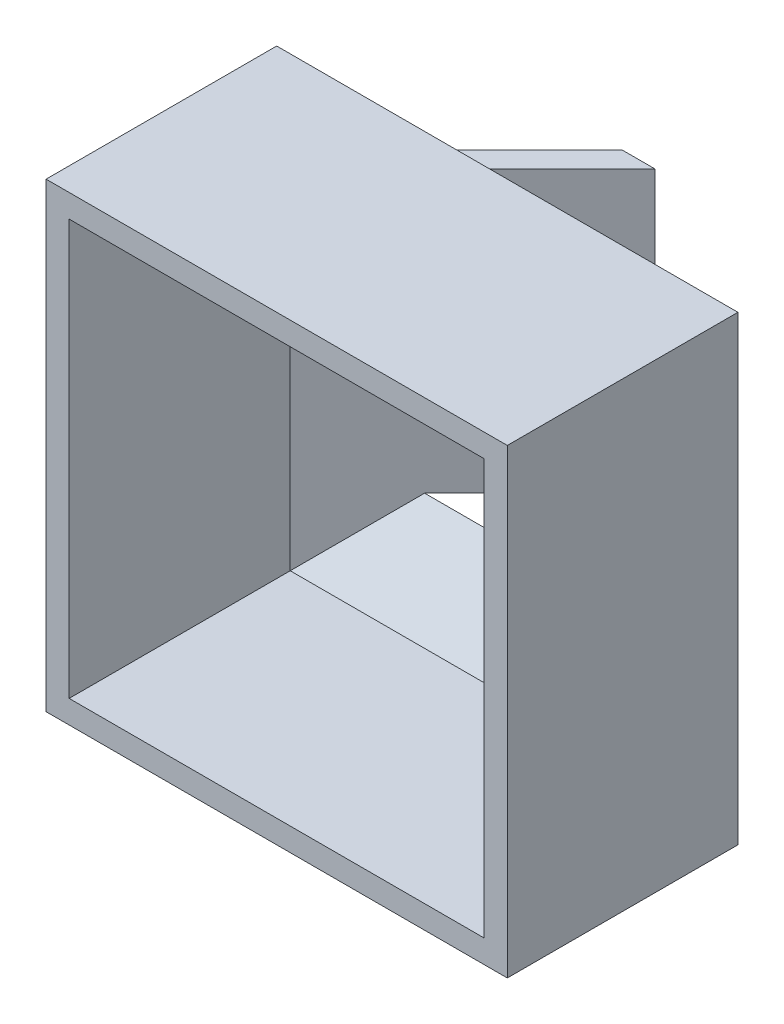
from build123d import *

# Parameters (mm, degrees)
SKETCH1_W           = 40
SKETCH1_H           = 40
BOSS_EXTRUDE1_DEPTH = 25
CHAMFER1_SIZE       = 5
CHAMFER2_SIZE       = 5
CHAMFER3_SIZE       = 5
CHAMFER4_SIZE       = 5
SHELL1_T            = -2
SKETCH7_W           = 10
SKETCH7_H           = 24.34314575
BOSS_EXTRUDE6_DEPTH = 10
CUT_EXTRUDE2_DEPTH  = 24.343146
SKETCH11_W          = 10
SKETCH11_H          = 24.34314575
BOSS_EXTRUDE8_DEPTH = 2.828427
CUT_EXTRUDE4_DEPTH  = 58.096498152


with BuildPart() as part:
    # Sketch1 → Boss-Extrude1 (new body)
    with BuildSketch(Plane.XY):
        with Locations((20, -20)):
            Rectangle(SKETCH1_W, SKETCH1_H)
    extrude(amount=BOSS_EXTRUDE1_DEPTH)

    # Chamfer1
    chamfer1_edges = [part.edges().sort_by_distance(p)[0] for p in [
        (0, -20, 0),
    ]]
    chamfer(chamfer1_edges, length=CHAMFER1_SIZE)

    # Chamfer2
    chamfer2_edges = [part.edges().sort_by_distance(p)[0] for p in [
        (40, -20, 0),
    ]]
    chamfer(chamfer2_edges, length=CHAMFER2_SIZE)

    # Chamfer3
    chamfer3_edges = [part.edges().sort_by_distance(p)[0] for p in [
        (20, -40, 0),
    ]]
    chamfer(chamfer3_edges, length=CHAMFER3_SIZE)

    # Chamfer4
    chamfer4_edges = [part.edges().sort_by_distance(p)[0] for p in [
        (20, 0, 0),
    ]]
    chamfer(chamfer4_edges, length=CHAMFER4_SIZE)

    # Shell1
    shell1_openings = [part.faces().sort_by_distance(p)[0] for p in [
        (20, -20, 25),
        (20, -20, 0),
    ]]
    offset(amount=SHELL1_T, openings=shell1_openings, kind=Kind.INTERSECTION)



with BuildPart() as body_2:
    # Sketch7 → Boss-Extrude6 (new body)
    with BuildSketch(Plane(origin=(0, 0, 0), x_dir=(-1, 0, 0), z_dir=(0, 0, -1))):
        with Locations((-12.828427125, -20)):
            Rectangle(SKETCH7_W, SKETCH7_H)
    extrude(amount=BOSS_EXTRUDE6_DEPTH)

    # Sketch8 → Cut-Extrude2 (cut)
    with BuildSketch(Plane(origin=(0, -7.828427125, 0), x_dir=(1, 0, 0), z_dir=(0, 1, 0))):
        Polygon((7.828427125, 0), (17.828427125, 0), (17.828427125, 10), align=None)
    extrude(amount=-CUT_EXTRUDE2_DEPTH, mode=Mode.SUBTRACT)


with BuildPart() as part_1:
    add(part.part)

    add(body_2.part)  # Boss-Extrude8 merges body 2
    # Sketch11 → Boss-Extrude8 (add)
    with BuildSketch(Plane.ZY.offset(-7.828427125)):
        with Locations((-5, -20)):
            Rectangle(SKETCH11_W, SKETCH11_H)
    extrude(amount=BOSS_EXTRUDE8_DEPTH)

    # Sketch13 → Cut-Extrude4 (cut, through all)
    with BuildSketch(Plane(origin=(0, -7.828427125, 0), x_dir=(1, 0, 0), z_dir=(0, 1, 0))):
        Polygon((5, 0), (15, 10), (5, 10), align=None)
    extrude(amount=-CUT_EXTRUDE4_DEPTH, mode=Mode.SUBTRACT)


solid = part_1.part
